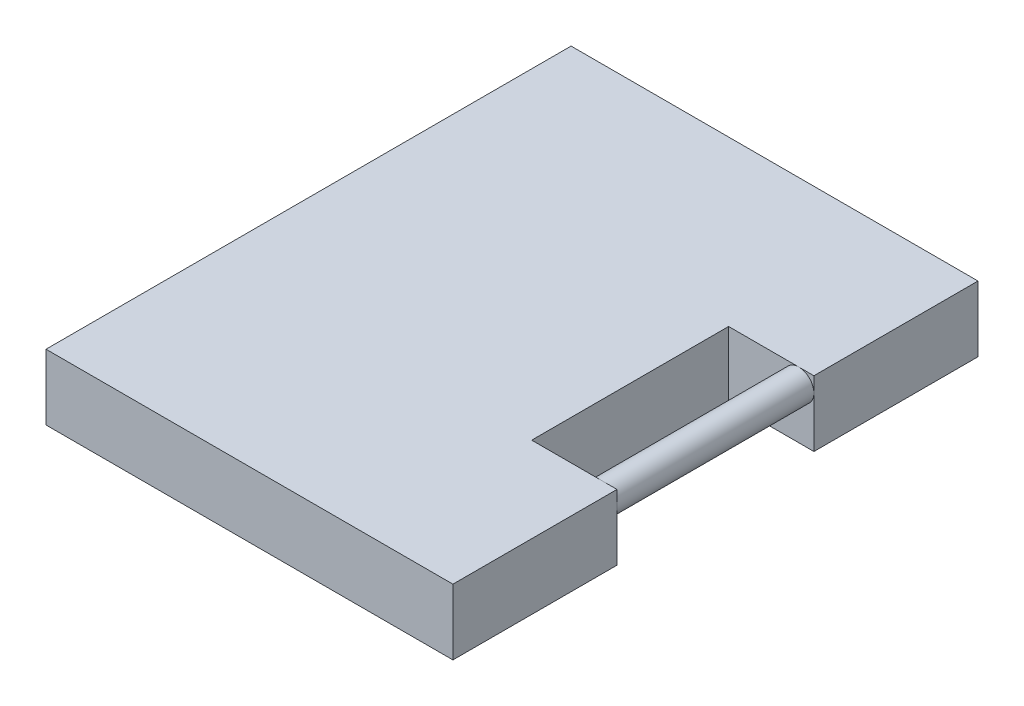
from build123d import *

# Parameters (mm, degrees)
BOSS_EXTRUDE1_DEPTH = 50
SKETCH2_R           = 11.5
BOSS_EXTRUDE2_DEPTH = 150


with BuildPart() as part:
    # Sketch1 → Boss-Extrude1 (new body)
    with BuildSketch(Plane(origin=(0, 0, 0), x_dir=(1, 0, 0), z_dir=(0, 1, 0))):
        Polygon((155, -200), (155, -75), (90, -75), (90, 75), (155, 75), (155, 200), (-155, 200), (-155, -200), align=None)
    extrude(amount=BOSS_EXTRUDE1_DEPTH)

    # Sketch2 → Boss-Extrude2 (add)
    with BuildSketch(Plane.XY.offset(-75)):
        with Locations(Location((143.5, 38.5, 0), (0, 0, 90))):
            Circle(SKETCH2_R)
    extrude(amount=BOSS_EXTRUDE2_DEPTH)


solid = part.part
